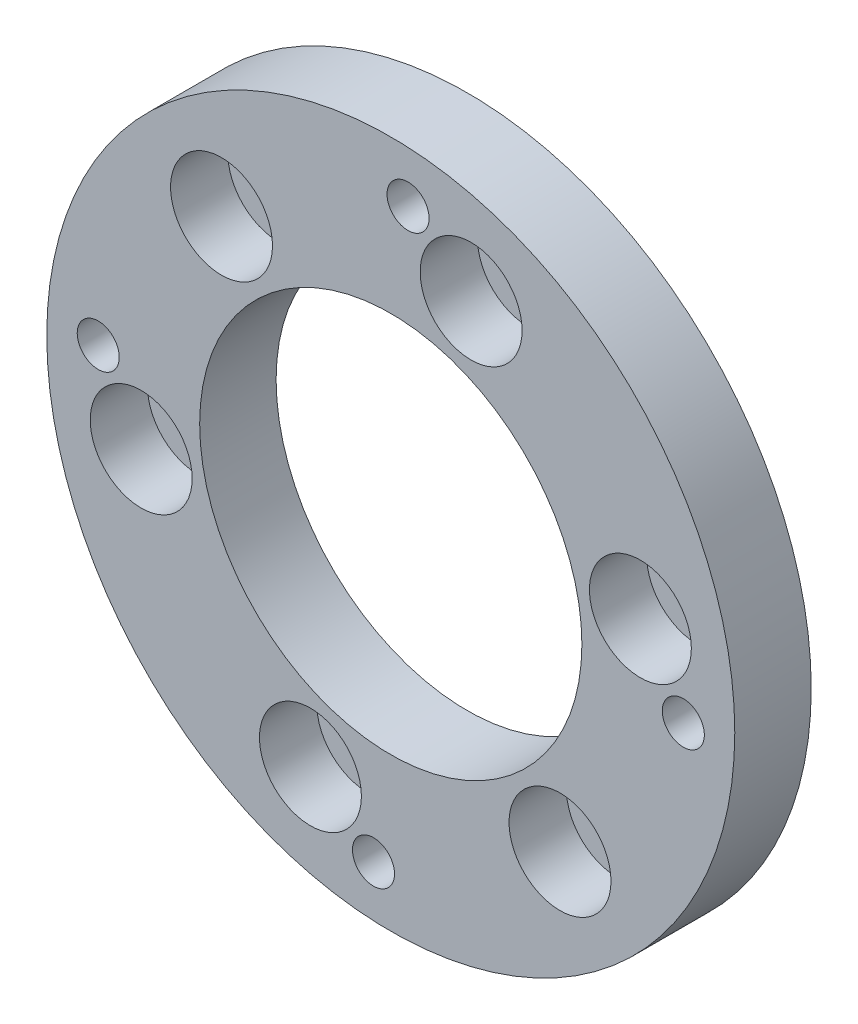
from build123d import *

# Parameters (mm, degrees)
ESQUISSE5_R                                     = 27
ESQUISSE5_R_2                                   = 15
BASE_EXTRUSION_DEPTH                            = 6
TROU_TARAUD_M4X0_71_D                           = 3.3
R_P_TITION_CIRCULAIRE1_COUNT                    = 4
CHAMBRAGE_POUR_VIS_T_TE_CYLINDRIQUE_D           = 4.5
CHAMBRAGE_POUR_VIS_T_TE_CYLINDRIQUE_CBORE_D     = 8
CHAMBRAGE_POUR_VIS_T_TE_CYLINDRIQUE_CBORE_DEPTH = 4.5
R_P_TITION_CIRCULAIRE2_COUNT                    = 6


with BuildPart() as part:
    # Esquisse5 → Base-Extrusion (new body)
    with BuildSketch(Plane.XY):
        with Locations(Location((0, 0, 0), (0, 0, 180))):
            Circle(ESQUISSE5_R)
        with Locations(Location((0, 0, 0), (0, 0, 180))):
            Circle(ESQUISSE5_R_2, mode=Mode.SUBTRACT)
    extrude(amount=BASE_EXTRUSION_DEPTH)

    # Trou taraudé M4x0.71 (through all)
    with Locations(Plane(origin=(0, 0, 0), x_dir=(-1, 0, 0), z_dir=(0, 0, -1))):
        with Locations((22.959989216, 1.356058707)):
            trou_taraud_m4x0_71 = Hole(TROU_TARAUD_M4X0_71_D / 2)

    # Répétition circulaire1: Trou taraudé M4x0.71 ×4 about axis
    r_p_tition_circulaire1_axis = Axis((0, 0, 0), (0, 0, -1))
    for i in range(1, R_P_TITION_CIRCULAIRE1_COUNT):
        add(trou_taraud_m4x0_71.rotate(r_p_tition_circulaire1_axis, i * 360 / R_P_TITION_CIRCULAIRE1_COUNT), mode=Mode.SUBTRACT)

    # Chambrage pour vis à tête cylindrique à 6 pans creux (vis CHC) M41 (through all)
    with Locations(Plane.XY.offset(6)):
        with Locations((-13.28372675, 14.951341198)):
            chambrage_pour_vis_t_te_cylindrique = CounterBoreHole(CHAMBRAGE_POUR_VIS_T_TE_CYLINDRIQUE_D / 2, CHAMBRAGE_POUR_VIS_T_TE_CYLINDRIQUE_CBORE_D / 2, CHAMBRAGE_POUR_VIS_T_TE_CYLINDRIQUE_CBORE_DEPTH)

    # Répétition circulaire2: Chambrage pour vis à tête cylindrique à 6 pans creux (vis CHC) M41 ×6 about axis
    r_p_tition_circulaire2_axis = Axis((0, 0, 0), (0, 0, -1))
    for i in range(1, R_P_TITION_CIRCULAIRE2_COUNT):
        add(chambrage_pour_vis_t_te_cylindrique.rotate(r_p_tition_circulaire2_axis, i * 360 / R_P_TITION_CIRCULAIRE2_COUNT), mode=Mode.SUBTRACT)


solid = part.part
